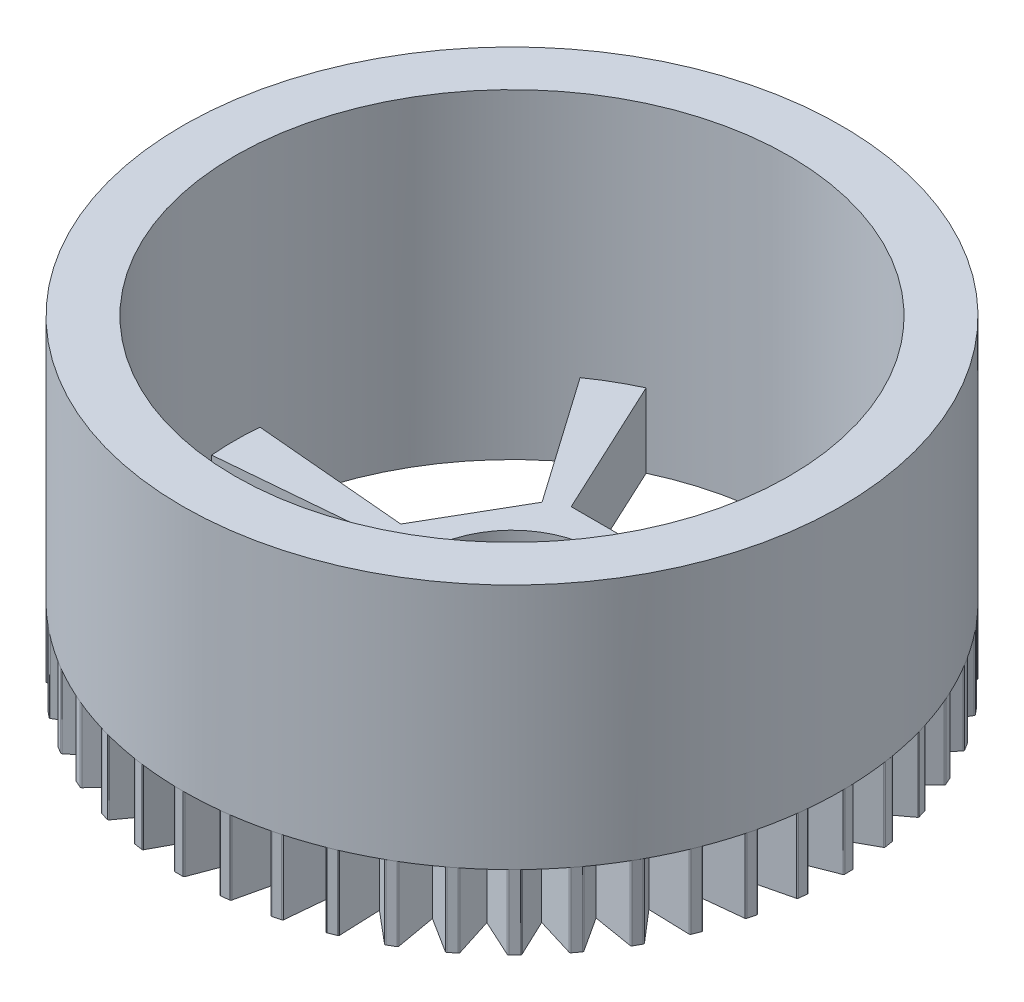
from build123d import *
from build123d.topology import SkipClean

# Parameters (mm, degrees)
SKETCH_2_R      = 3.5
EXTRUDE_4_DEPTH = 3
SKETCH_4_R      = 13.371220774
SKETCH_4_R_2    = 11.25
EXTRUDE_5_DEPTH = 10


with BuildPart() as part:
    # 草图2 → 凸台-拉伸4 (new body)
    with BuildSketch(Plane(origin=(0, 0, 0), x_dir=(1, 0, 0), z_dir=(0, 1, 0))):
        with BuildLine():
            Line((5.266078056, -12.256597527), (5.197407022, -10.576402295))
            Line((5.197407022, -10.576402295), (6.485585802, -11.657312634))
            ThreePointArc((6.485585802, -11.657312634), (6.513367395, -11.668820146), (6.542725182, -11.662311682))
            Line((6.542725182, -11.662311682), (6.828495592, -11.497322059))
            ThreePointArc((6.828495592, -11.497322059), (6.848810981, -11.475151702), (6.85273598, -11.44533838))
            Line((6.85273598, -11.44533838), (6.560729557, -9.789287662))
            Line((6.560729557, -9.789287662), (7.981485794, -10.688856138))
            ThreePointArc((7.981485794, -10.688856138), (8.010553307, -10.696558051), (8.038781656, -10.686194648))
            Line((8.038781656, -10.686194648), (8.300011311, -10.484587679))
            ThreePointArc((8.300011311, -10.484587679), (8.317190417, -10.459907361), (8.317106668, -10.429836898))
            Line((8.317106668, -10.429836898), (7.806975717, -8.827482959))
            Line((7.806975717, -8.827482959), (9.334955984, -9.529656752))
            ThreePointArc((9.334955984, -9.529656752), (9.364790706, -9.533415624), (9.391385881, -9.519382218))
            Line((9.391385881, -9.519382218), (9.623413132, -9.284755584))
            ThreePointArc((9.623413132, -9.284755584), (9.637149393, -9.258005726), (9.63305839, -9.228214729))
            Line((9.63305839, -9.228214729), (8.913906211, -7.708151614))
            Line((8.913906211, -7.708151614), (10.521843663, -8.200400415))
            ThreePointArc((10.521843663, -8.200400415), (10.551913193, -8.200149169), (10.576400602, -8.182696187))
            Line((10.576400602, -8.182696187), (10.775084918, -7.919236806))
            ThreePointArc((10.775084918, -7.919236806), (10.785133209, -7.890894759), (10.777107957, -7.86191485))
            Line((10.777107957, -7.86191485), (9.861767838, -6.451268121))
            Line((9.861767838, -6.451268121), (11.520968792, -6.724807738))
            ThreePointArc((11.520968792, -6.724807738), (11.550736539, -6.720550858), (11.572679204, -6.699989748))
            Line((11.572679204, -6.699989748), (11.734475058, -6.412399059))
            ThreePointArc((11.734475058, -6.412399059), (11.740656068, -6.382970588), (11.728839778, -6.355318914))
            Line((11.728839778, -6.355318914), (10.633645984, -5.079261595))
            Line((10.633645984, -5.079261595), (12.314501961, -5.129210708))
            ThreePointArc((12.314501961, -5.129210708), (12.343436718, -5.121024158), (12.362443071, -5.097721834))
            Line((12.362443071, -5.097721834), (12.484463212, -4.791131899))
            ThreePointArc((12.484463212, -4.791131899), (12.486666641, -4.761142156), (12.471270174, -4.735312162))
            Line((12.471270174, -4.735312162), (11.215766465, -3.616615525))
            Line((11.215766465, -3.616615525), (12.88828255, -3.442082792))
            ThreePointArc((12.88828255, -3.442082792), (12.915867976, -3.43011266), (12.931598849, -3.404484952))
            Line((12.931598849, -3.404484952), (13.011665825, -3.084366877))
            ThreePointArc((13.011665825, -3.084366877), (13.009852352, -3.054351029), (12.991150459, -3.030803652))
            Line((12.991150459, -3.030803652), (11.597741328, -2.089430866))
            Line((11.597741328, -2.089430866), (13.232071432, -1.693530826))
            ThreePointArc((13.232071432, -1.693530826), (13.257815264, -1.677990721), (13.269989939, -1.650494956))
            Line((13.269989939, -1.650494956), (13.306674953, -1.322561255))
            ThreePointArc((13.306674953, -1.322561255), (13.30087694, -1.293054936), (13.279203356, -1.272210379))
            Line((13.279203356, -1.272210379), (11.772754222, -0.524960264))
            Line((11.772754222, -0.524960264), (13.339733685, 0.085242237))
            ThreePointArc((13.339733685, 0.085242237), (13.363176525, 0.104075003), (13.371577744, 0.132948161))
            Line((13.371577744, 0.132948161), (13.364226151, 0.462845504))
            ThreePointArc((13.364226151, 0.462845504), (13.354547063, 0.491315753), (13.330288555, 0.509085518))
            Line((13.330288555, 0.509085518), (11.737682038, 1.048878267))
            Line((11.737682038, 1.048878267), (13.209348075, 1.86249415))
            ThreePointArc((13.209348075, 1.86249415), (13.230071584, 1.884283505), (13.234549427, 1.914018816))
            Line((13.234549427, 1.914018816), (13.183292417, 2.239992774))
            ThreePointArc((13.183292417, 2.239992774), (13.169904978, 2.266918901), (13.143494439, 2.281296773))
            Line((13.143494439, 2.281296773), (11.49315064, 2.60399954))
            Line((11.49315064, 2.60399954), (12.843241336, 3.606509812))
            ThreePointArc((12.843241336, 3.606509812), (12.860875702, 3.630866924), (12.861350263, 3.660933759))
            Line((12.861350263, 3.660933759), (12.767102517, 3.97716732))
            ThreePointArc((12.767102517, 3.97716732), (12.750245627, 4.002068827), (12.722154353, 4.012798232))
            Line((12.722154353, 4.012798232), (11.043523697, 4.11265238))
            Line((11.043523697, 4.11265238), (12.247946651, 5.28616722))
            ThreePointArc((12.247946651, 5.28616722), (12.262177188, 5.312657437), (12.258639998, 5.342519253))
            Line((12.258639998, 5.342519253), (12.12308337, 5.643369221))
            ThreePointArc((12.12308337, 5.643369221), (12.10305784, 5.66580174), (12.073787121, 5.672691212))
            Line((12.073787121, 5.672691212), (10.396824812, 5.547914841))
            Line((10.396824812, 5.547914841), (11.434087067, 6.871492849))
            ThreePointArc((11.434087067, 6.871492849), (11.444659832, 6.899643451), (11.437174012, 6.928767364))
            Line((11.437174012, 6.928767364), (11.262727514, 7.208865065))
            ThreePointArc((11.262727514, 7.208865065), (11.239890699, 7.228428287), (11.209962872, 7.231354882))
            Line((11.209962872, 7.231354882), (9.564594342, 6.88417463))
            Line((9.564594342, 6.88417463), (10.416185929, 8.334196525))
            ThreePointArc((10.416185929, 8.334196525), (10.422912251, 8.363505165), (10.411611385, 8.391371457))
            Line((10.411611385, 8.391371457), (10.201388018, 8.64571854))
            ThreePointArc((10.201388018, 8.64571854), (10.176147443, 8.66206336), (10.14609657, 8.660974854))
            Line((10.14609657, 8.660974854), (8.561683459, 8.097586159))
            Line((8.561683459, 8.097586159), (9.212407706, 9.648176267))
            ThreePointArc((9.212407706, 9.648176267), (9.215167553, 9.678119931), (9.200253306, 9.704231328))
            Line((9.200253306, 9.704231328), (8.958004511, 9.928288964))
            ThreePointArc((8.958004511, 9.928288964), (8.930810594, 9.941123707), (8.901172935, 9.936039524))
            Line((8.901172935, 9.936039524), (7.405989131, 9.166496072))
            Line((7.405989131, 9.166496072), (7.84423385, 10.789984075))
            ThreePointArc((7.84423385, 10.789984075), (7.842977972, 10.820028418), (7.824716489, 10.843918961))
            Line((7.824716489, 10.843918961), (7.554765202, 11.033688835))
            ThreePointArc((7.554765202, 11.033688835), (7.526103219, 11.042784467), (7.497407657, 11.033795333))
            Line((7.497407657, 11.033795333), (6.118134753, 10.071829645))
            Line((6.118134753, 10.071829645), (6.336079455, 11.739244361))
            ThreePointArc((6.336079455, 11.739244361), (6.330830263, 11.768853241), (6.309547421, 11.790096603))
            Line((6.309547421, 11.790096603), (6.016710928, 11.942192268))
            ThreePointArc((6.016710928, 11.942192268), (5.987092353, 11.947386475), (5.959850962, 11.934652803))
            Line((5.959850962, 11.934652803), (4.721102115, 10.797431179))
            Line((4.721102115, 10.797431179), (4.714857571, 12.479017554))
            ThreePointArc((4.714857571, 12.479017554), (4.705708738, 12.5076626), (4.68178433, 12.525879692))
            Line((4.68178433, 12.525879692), (4.371288306, 12.637586997))
            ThreePointArc((4.371288306, 12.637586997), (4.341241683, 12.638787089), (4.315940586, 12.622536112))
            Line((4.315940586, 12.622536112), (3.239821297, 11.330352299))
            Line((3.239821297, 11.330352299), (3.009498943, 12.996102383))
            ThreePointArc((3.009498943, 12.996102383), (2.99661373, 13.023272422), (2.970474686, 13.038138161))
            Line((2.970474686, 13.038138161), (2.64785994, 13.107463687))
            ThreePointArc((2.64785994, 13.107463687), (2.617921452, 13.104648248), (2.595012147, 13.085169964))
            Line((2.595012147, 13.085169964), (1.700725792, 11.661083013))
            Line((1.700725792, 11.661083013), (1.250435735, 13.281271457))
            ThreePointArc((1.250435735, 13.281271457), (1.234044078, 13.30648164), (1.206156851, 13.317730746))
            Line((1.206156851, 13.317730746), (0.877180451, 13.343437377))
            ThreePointArc((0.877180451, 13.343437377), (0.84788435, 13.336656649), (0.827775656, 13.314298648))
            Line((0.827775656, 13.314298648), (0.131280795, 11.783721424))
            Line((0.131280795, 11.783721424), (-0.530941529, 13.329435927))
            ThreePointArc((-0.530941529, 13.329435927), (-0.55054712, 13.352236378), (-0.579684881, 13.35966811))
            Line((-0.579684881, 13.35966811), (-0.909152344, 13.34129711))
            ThreePointArc((-0.909152344, 13.34129711), (-0.937283267, 13.330672095), (-0.954232512, 13.305833358))
            Line((-0.954232512, 13.305833358), (-1.440506911, 11.696079048))
            Line((-1.440506911, 11.696079048), (-2.302844128, 13.139736297))
            ThreePointArc((-2.302844128, 13.139736297), (-2.325313791, 13.159720142), (-2.355182123, 13.16320188))
            Line((-2.355182123, 13.16320188), (-2.679261294, 13.101081081))
            ThreePointArc((-2.679261294, 13.101081081), (-2.705725043, 13.086801383), (-2.719212378, 13.059925156))
            Line((-2.719212378, 13.059925156), (-2.986588737, 11.399719863))
            Line((-2.986588737, 11.399719863), (-4.03365242, 12.715557762))
            ThreePointArc((-4.03365242, 12.715557762), (-4.058585182, 12.732368387), (-4.088651084, 12.731838001))
            Line((-4.088651084, 12.731838001), (-4.401558763, 12.627075949))
            ThreePointArc((-4.401558763, 12.627075949), (-4.425883091, 12.609396389), (-4.435667835, 12.58096228))
            Line((-4.435667835, 12.58096228), (-4.479374816, 10.899932408))
            Line((-4.479374816, 10.899932408), (-5.692480088, 12.064469797))
            ThreePointArc((-5.692480088, 12.064469797), (-5.719431025, 12.077807218), (-5.74915797, 12.073274171))
            Line((-5.74915797, 12.073274171), (-6.045310311, 11.927740348))
            ThreePointArc((-6.045310311, 11.927740348), (-6.067061151, 11.906976418), (-6.072968694, 11.877491834))
            Line((-6.072968694, 11.877491834), (-5.892226346, 10.205635401))
            Line((-5.892226346, 10.205635401), (-7.249725315, 11.198091083))
            ThreePointArc((-7.249725315, 11.198091083), (-7.278213485, 11.207717292), (-7.307070996, 11.199262477))
            Line((-7.307070996, 11.199262477), (-7.581183154, 11.015553938))
            ThreePointArc((-7.581183154, 11.015553938), (-7.59997236, 10.992076172), (-7.601897283, 10.962067265))
            Line((-7.601897283, 10.962067265), (-7.199930957, 9.329218588))
            Line((-7.199930957, 9.329218588), (-8.677599021, 10.131882168))
            ThreePointArc((-8.677599021, 10.131882168), (-8.707116054, 10.137625386), (-8.734589166, 10.12539968))
            Line((-8.734589166, 10.12539968), (-8.981769604, 9.906794707))
            ThreePointArc((-8.981769604, 9.906794707), (-8.997261883, 9.881022065), (-8.995169835, 9.851024346))
            Line((-8.995169835, 9.851024346), (-8.379152629, 8.286321649))
            Line((-8.379152629, 8.286321649), (-9.950620767, 8.884869576))
            ThreePointArc((-9.950620767, 8.884869576), (-9.98063993, 8.886627314), (-10.006238386, 8.870848885))
            Line((-10.006238386, 8.870848885), (-10.222076162, 8.621248489))
            ThreePointArc((-10.222076162, 8.621248489), (-10.233995054, 8.593640885), (-10.227923368, 8.564189665))
            Line((-10.227923368, 8.564189665), (-9.408848124, 7.095555103))
            Line((-9.408848124, 7.095555103), (-11.04607345, 7.479306275))
            ThreePointArc((-11.04607345, 7.479306275), (-11.07605905, 7.477047168), (-11.099326045, 7.457997581))
            Line((-11.099326045, 7.457997581), (-11.279969529, 7.181855888))
            ThreePointArc((-11.279969529, 7.181855888), (-11.288102341, 7.152905981), (-11.278159366, 7.124526815))
            Line((-11.278159366, 7.124526815), (-10.270642502, 5.778168209))
            Line((-10.270642502, 5.778168209), (-11.944408691, 5.940274578))
            ThreePointArc((-11.944408691, 5.940274578), (-11.973825634, 5.934038937), (-11.994345968, 5.912058134))
            Line((-11.994345968, 5.912058134), (-12.136571572, 5.614302899))
            ThreePointArc((-12.136571572, 5.614302899), (-12.140773175, 5.584527299), (-12.127136343, 5.557726616))
            Line((-12.127136343, 5.557726616), (-10.949157021, 4.357669765))
            Line((-10.949157021, 4.357669765), (-12.629595675, 4.295238539))
            ThreePointArc((-12.629595675, 4.295238539), (-12.657919016, 4.285137642), (-12.675326502, 4.26061787))
            Line((-12.675326502, 4.26061787), (-12.776596209, 3.946562541))
            ThreePointArc((-12.776596209, 3.946562541), (-12.776791623, 3.916492596), (-12.759704285, 3.891748654))
            Line((-12.759704285, 3.891748654), (-11.432283573, 2.859408602))
            Line((-11.432283573, 2.859408602), (-13.089407226, 2.573553867))
            ThreePointArc((-13.089407226, 2.573553867), (-13.116131534, 2.559767963), (-13.130115535, 2.533146778))
            Line((-13.130115535, 2.533146778), (-13.188622183, 2.208395681))
            ThreePointArc((-13.188622183, 2.208395681), (-13.184807922, 2.17856799), (-13.164575002, 2.156322345))
            Line((-13.164575002, 2.156322345), (-11.711400754, 1.310121225))
            Line((-11.711400754, 1.310121225), (-13.315637994, 0.805944066))
            ThreePointArc((-13.315637994, 0.805944066), (-13.340286373, 0.788719165), (-13.350597346, 0.760471623))
            Line((-13.350597346, 0.760471623), (-13.365296882, 0.430819948))
            ThreePointArc((-13.365296882, 0.430819948), (-13.357541012, 0.401766786), (-13.334523566, 0.382416413))
            Line((-13.334523566, 0.382416413), (-11.781527712, -0.262545297))
            Line((-11.781527712, -0.262545297), (-13.304250887, -0.976047827))
            ThreePointArc((-13.304250887, -0.976047827), (-13.326383486, -0.996404346), (-13.33283743, -1.025774167))
            Line((-13.33283743, -1.025774167), (-13.303467541, -1.354443777))
            ThreePointArc((-13.303467541, -1.354443777), (-13.291908466, -1.382203956), (-13.26651724, -1.39831375))
            Line((-13.26651724, -1.39831375), (-11.641413028, -1.830526692))
            Line((-11.641413028, -1.830526692), (-13.055449108, -2.740622123))
            ThreePointArc((-13.055449108, -2.740622123), (-13.07467097, -2.763746997), (-13.077152714, -2.793714992))
            Line((-13.077152714, -2.793714992), (-13.004237508, -3.115537421))
            ThreePointArc((-13.004237508, -3.115537421), (-12.989081498, -3.141509235), (-12.961769601, -3.15409097))
            Line((-12.961769601, -3.15409097), (-11.293557052, -3.365842295))
            Line((-11.293557052, -3.365842295), (-12.57367253, -4.456289952))
            ThreePointArc((-12.57367253, -4.456289952), (-12.589640641, -4.481770518), (-12.588105899, -4.511801907))
            Line((-12.588105899, -4.511801907), (-12.472946547, -4.821034225))
            ThreePointArc((-12.472946547, -4.821034225), (-12.454464063, -4.844754208), (-12.425718876, -4.853583362))
            Line((-12.425718876, -4.853583362), (-10.744167284, -4.841094362))
            Line((-10.744167284, -4.841094362), (-11.867518468, -6.092435182))
            ThreePointArc((-11.867518468, -6.092435182), (-11.879947876, -6.119816738), (-11.874424035, -6.14937561))
            Line((-11.874424035, -6.14937561), (-11.71907556, -6.44049956))
            ThreePointArc((-11.71907556, -6.44049956), (-11.697596422, -6.461544427), (-11.667930903, -6.466463445))
            Line((-11.667930903, -6.466463445), (-10.003047596, -6.229956985))
            Line((-10.003047596, -6.229956985), (-10.949588258, -7.619860761))
            ThreePointArc((-10.949588258, -7.619860761), (-10.95825716, -7.648654683), (-10.948842794, -7.67721356))
            Line((-10.948842794, -7.67721356), (-10.756077392, -7.945034028))
            ThreePointArc((-10.756077392, -7.945034028), (-10.731984896, -7.963028232), (-10.701928426, -7.963949334))
            Line((-10.701928426, -7.963949334), (-9.083423287, -7.507645879))
            Line((-9.083423287, -7.507645879), (-9.836262386, -9.011309745))
            ThreePointArc((-9.836262386, -9.011309745), (-9.841016085, -9.041002204), (-9.827879193, -9.068051452))
            Line((-9.827879193, -9.068051452), (-9.601136768, -9.307789175))
            ThreePointArc((-9.601136768, -9.307789175), (-9.574860845, -9.322411611), (-9.544949784, -9.319318358))
            Line((-9.544949784, -9.319318358), (-8.001705074, -8.651360654))
            Line((-8.001705074, -8.651360654), (-8.547408178, -10.241951692))
            ThreePointArc((-8.547408178, -10.241951692), (-8.548161845, -10.272012826), (-8.531536855, -10.297069751))
            Line((-8.531536855, -10.297069751), (-8.274863631, -10.504446604))
            ThreePointArc((-8.274863631, -10.504446604), (-8.246873175, -10.515436333), (-8.217641286, -10.508383925))
            Line((-8.217641286, -10.508383925), (-6.777196244, -9.640691693))
            Line((-6.777196244, -9.640691693), (-7.106025269, -11.289825769))
            ThreePointArc((-7.106025269, -11.289825769), (-7.102765455, -11.319719136), (-7.08294904, -11.342336596))
            Line((-7.08294904, -11.342336596), (-6.800925357, -11.513651934))
            ThreePointArc((-6.800925357, -11.513651934), (-6.771719858, -11.520812844), (-6.743688785, -11.509927133))
            Line((-6.743688785, -11.509927133), (-5.431748187, -10.457984361))
            Line((-5.431748187, -10.457984361), (-5.537835171, -12.136232638))
            ThreePointArc((-5.537835171, -12.136232638), (-5.530620047, -12.165424791), (-5.507965832, -12.185199176))
            Line((-5.507965832, -12.185199176), (-5.205624408, -12.317395873))
            ThreePointArc((-5.205624408, -12.317395873), (-5.17572504, -12.320600178), (-5.149394998, -12.306075418))
            Line((-5.149394998, -12.306075418), (-3.989370454, -11.088654049))
            Line((-3.989370454, -11.088654049), (-3.870822273, -12.766068148))
            ThreePointArc((-3.870822273, -12.766068148), (-3.859780592, -12.794038151), (-3.834692843, -12.810616588))
            Line((-3.834692843, -12.810616588), (-3.517428969, -12.901335591))
            ThreePointArc((-3.517428969, -12.901335591), (-3.487369286, -12.900526109), (-3.463210135, -12.882621495))
            Line((-3.463210135, -12.882621495), (-2.475802312, -11.521446444))
            Line((-2.475802312, -11.521446444), (-2.13473446, -13.168092869))
            ThreePointArc((-2.13473446, -13.168092869), (-2.120063262, -13.194341598), (-2.092989669, -13.207428244))
            Line((-2.092989669, -13.207428244), (-1.766464926, -13.255050669))
            ThreePointArc((-1.766464926, -13.255050669), (-1.736781345, -13.250241847), (-1.715224205, -13.229276887))
            Line((-1.715224205, -13.229276887), (-0.918053418, -11.748638354))
            Line((-0.918053418, -11.748638354), (-0.36055226, -13.335132661))
            ThreePointArc((-0.36055226, -13.335132661), (-0.342513353, -13.359191706), (-0.313937045, -13.36855303))
            Line((-0.313937045, -13.36855303), (0.016021725, -13.372229054))
            ThreePointArc((0.016021725, -13.372229054), (0.044799501, -13.363506704), (0.063369941, -13.33985552))
            Line((0.063369941, -13.33985552), (0.65607816, -11.766175534))
            Line((0.65607816, -11.766175534), (1.420064004, -13.264206695))
            ThreePointArc((1.420064004, -13.264206695), (1.441148715, -13.285646722), (1.470717793, -13.29111567))
            Line((1.470717793, -13.29111567), (1.798222468, -13.250779695))
            ThreePointArc((1.798222468, -13.250779695), (1.825580899, -13.238299468), (1.840833249, -13.212384114))
            Line((1.840833249, -13.212384114), (2.218502008, -11.573745033))
            Line((2.218502008, -11.573745033), (3.175339192, -12.956580646))
            ThreePointArc((3.175339192, -12.956580646), (3.19909345, -12.975019057), (3.229127638, -12.976498036))
            Line((3.229127638, -12.976498036), (3.548333889, -12.892869858))
            ThreePointArc((3.548333889, -12.892869858), (3.573784762, -12.876854465), (3.585446845, -12.849137401))
            Line((3.585446845, -12.849137401), (3.741336636, -11.174780778))
            Line((3.741336636, -11.174780778), (4.873950377, -12.417744109))
            ThreePointArc((4.873950377, -12.417744109), (4.899950287, -12.43285187), (4.929913623, -12.430314487))
            Line((4.929913623, -12.430314487), (5.235125207, -12.304886454))
            ThreePointArc((5.235125207, -12.304886454), (5.258214352, -12.285621688), (5.266078056, -12.256597527))
        make_face()
        with BuildLine():
            Line((-6.452734909, 9.215460498), (-2.847922086, 4.067254251))
            Line((-2.847922086, 4.067254251), (-4.946306548, 0.432745749))
            Line((-4.946306548, 0.432745749), (-11.207190354, 0.980502106))
            ThreePointArc((-11.207190354, 0.980502106), (-9.742785793, 5.625), (-6.452734909, 9.215460498))
        make_face(mode=Mode.SUBTRACT)
        with BuildLine():
            Line((-11.207190354, -0.980502106), (-4.946306548, -0.432745749))
            Line((-4.946306548, -0.432745749), (-2.847922086, -4.067254251))
            Line((-2.847922086, -4.067254251), (-6.452734909, -9.215460498))
            ThreePointArc((-6.452734909, -9.215460498), (-9.742785793, -5.625), (-11.207190354, -0.980502106))
        make_face(mode=Mode.SUBTRACT)
        with BuildLine():
            Line((-4.754455445, -10.195962604), (-2.098384462, -4.5))
            Line((-2.098384462, -4.5), (2.098384462, -4.5))
            Line((2.098384462, -4.5), (4.754455445, -10.195962604))
            ThreePointArc((4.754455445, -10.195962604), (0, -11.25), (-4.754455445, -10.195962604))
        make_face(mode=Mode.SUBTRACT)
        with BuildLine():
            Line((6.452734909, -9.215460498), (2.847922086, -4.067254251))
            Line((2.847922086, -4.067254251), (4.946306548, -0.432745749))
            Line((4.946306548, -0.432745749), (11.207190354, -0.980502106))
            ThreePointArc((11.207190354, -0.980502106), (9.742785793, -5.625), (6.452734909, -9.215460498))
        make_face(mode=Mode.SUBTRACT)
        with BuildLine():
            Line((11.207190354, 0.980502106), (4.946306548, 0.432745749))
            Line((4.946306548, 0.432745749), (2.847922086, 4.067254251))
            Line((2.847922086, 4.067254251), (6.452734909, 9.215460498))
            ThreePointArc((6.452734909, 9.215460498), (9.742785793, 5.625), (11.207190354, 0.980502106))
        make_face(mode=Mode.SUBTRACT)
        with BuildLine():
            Line((4.754455445, 10.195962604), (2.098384462, 4.5))
            Line((2.098384462, 4.5), (-2.098384462, 4.5))
            Line((-2.098384462, 4.5), (-4.754455445, 10.195962604))
            ThreePointArc((-4.754455445, 10.195962604), (0, 11.25), (4.754455445, 10.195962604))
        make_face(mode=Mode.SUBTRACT)
        with Locations(Location((0, 0, 0), (0, 0, 270))):
            Circle(SKETCH_2_R, mode=Mode.SUBTRACT)
    extrude(amount=EXTRUDE_4_DEPTH)

    # 草图4 → 凸台-拉伸5 (add)
    with SkipClean():  # the faces are left unmerged after this step: merging them gives an invalid solid
        with BuildSketch(Plane(origin=(0, 3, 0), x_dir=(1, 0, 0), z_dir=(0, 1, 0))):
            with Locations(Location((0, 0, 0), (0, 0, 92.438720532))):
                Circle(SKETCH_4_R)
            with Locations(Location((0, 0, 0), (0, 0, 115))):
                Circle(SKETCH_4_R_2, mode=Mode.SUBTRACT)
        extrude(amount=EXTRUDE_5_DEPTH)


solid = part.part
